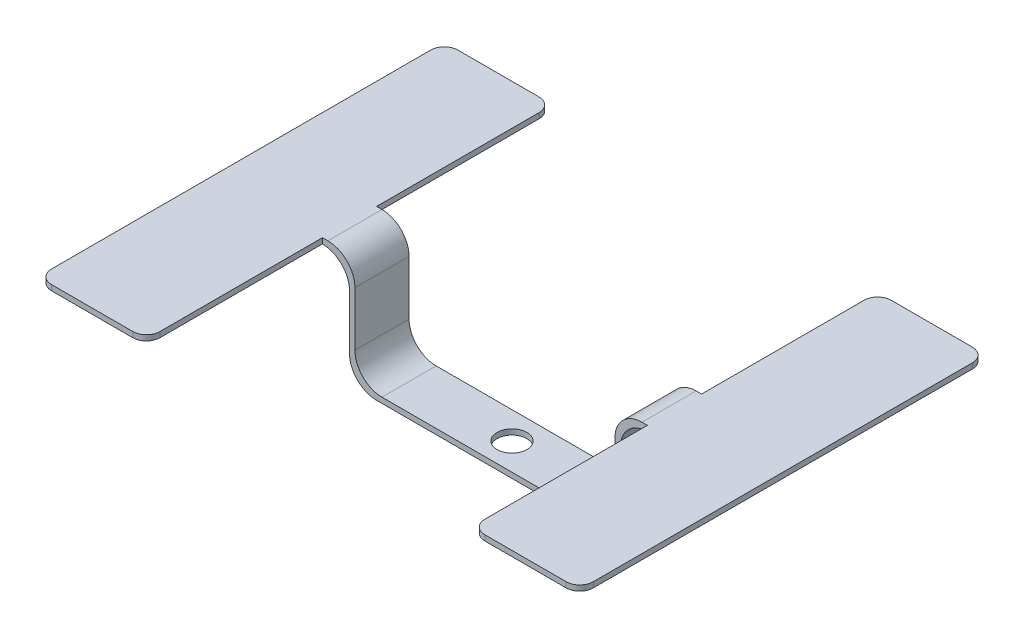
from build123d import *

# Parameters (mm, degrees)
BOSS_EXTRUDE1_DEPTH = 10
FILLET1_R           = 10
SKETCH2_W           = 40
SKETCH2_H           = 2
BOSS_EXTRUDE2_DEPTH = 75
FILLET2_R           = 5
CUT_EXTRUDE1_REACH  = 219.69
SKETCH4_R           = 5.5


with BuildPart() as part:
    # Sketch1 → Boss-Extrude1 (new, symmetric)
    with BuildSketch(Plane.XY):
        Polygon((0, 0), (-50, 0), (-50, -40), (-100, -40), (-100, -38), (-52, -38), (-52, 2), (0, 2), align=None)
    extrude(amount=BOSS_EXTRUDE1_DEPTH, both=True)

    # Fillet1
    fillet1_edges = [part.edges().sort_by_distance(p)[0] for p in [
        (-50, 0, 0),
        (-50, -40, 0),
        (-52, -38, 0),
        (-52, 2, 0),
    ]]
    fillet(fillet1_edges, radius=FILLET1_R)

    # Sketch2 → Boss-Extrude2 (add, symmetric)
    with BuildSketch(Plane.XY):
        with Locations((-20, 1)):
            Rectangle(SKETCH2_W, SKETCH2_H)
    extrude(amount=BOSS_EXTRUDE2_DEPTH, both=True)

    # Fillet2
    fillet2_edges = [part.edges().sort_by_distance(p)[0] for p in [
        (-40, 1, -75),
        (0, 1, -75),
        (-40, 1, 75),
        (0, 1, 75),
    ]]
    fillet(fillet2_edges, radius=FILLET2_R)

    # Mirror1: part across plane


with BuildPart() as part_1:
    add(part.part)
    add(part.part.mirror(Plane(origin=(-100, -38, 10), x_dir=(0, 0, 1), z_dir=(1, 0, 0))))

    # Sketch4 → Cut-Extrude1 (cut, up to next)
    with BuildSketch(Plane.XZ.offset(40), mode=Mode.PRIVATE) as cut_extrude1_sk1:
        with Locations((-100, 0)):
            Circle(SKETCH4_R)
    cut_extrude1_tool1 = extrude(cut_extrude1_sk1.sketch, amount=-CUT_EXTRUDE1_REACH, mode=Mode.PRIVATE) & part_1.part
    add(cut_extrude1_tool1.solids().sort_by_distance((-100, -40, 0))[0], mode=Mode.SUBTRACT)


solid = part_1.part
